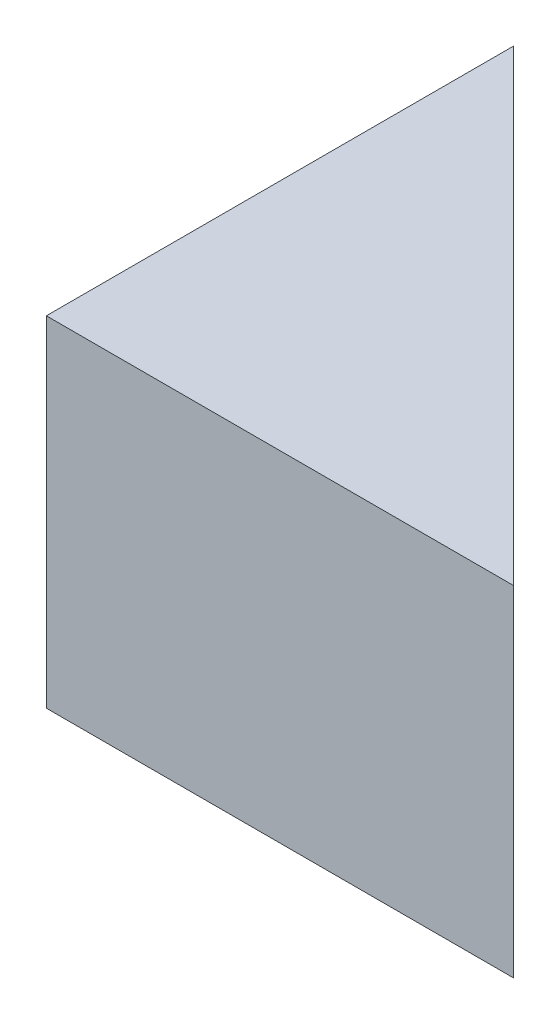
from build123d import *

# Parameters (mm, degrees)
BOSS_EXTRUDE1_DEPTH = 20


with BuildPart() as part:
    # Sketch1 → Boss-Extrude1 (new body)
    with BuildSketch(Plane(origin=(0, 0, 0), x_dir=(1, 0, 0), z_dir=(0, 1, 0))):
        Polygon((0, 0), (0, 27.5), (27.5, 0), align=None)
    extrude(amount=BOSS_EXTRUDE1_DEPTH)


solid = part.part
